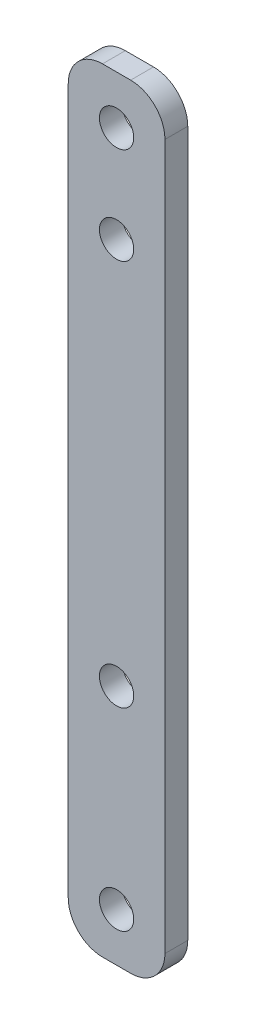
from build123d import *

# Parameters (mm, degrees)
SKETCH1_W           = 12.7
SKETCH1_H           = 101.6
SKETCH1_R           = 2.25
BOSS_EXTRUDE1_DEPTH = 3
FILLET1_R           = 4.5


with BuildPart() as part:
    # Sketch1 → Boss-Extrude1 (new body)
    with BuildSketch(Plane.XY):
        with Locations((6.35, 50.8)):
            Rectangle(SKETCH1_W, SKETCH1_H)
        with Locations((6.35, 6.35)):
            Circle(SKETCH1_R, mode=Mode.SUBTRACT)
        with Locations((6.35, 95.25)):
            Circle(SKETCH1_R, mode=Mode.SUBTRACT)
        with Locations((6.35, 82.55)):
            Circle(SKETCH1_R, mode=Mode.SUBTRACT)
        with Locations((6.35, 31.75)):
            Circle(SKETCH1_R, mode=Mode.SUBTRACT)
    extrude(amount=BOSS_EXTRUDE1_DEPTH)

    # Fillet1
    fillet1_edges = [part.edges().sort_by_distance(p)[0] for p in [
        (0, 101.6, 1.5),
        (12.7, 101.6, 1.5),
        (12.7, 0, 1.5),
        (0, 0, 1.5),
    ]]
    fillet(fillet1_edges, radius=FILLET1_R)


solid = part.part
